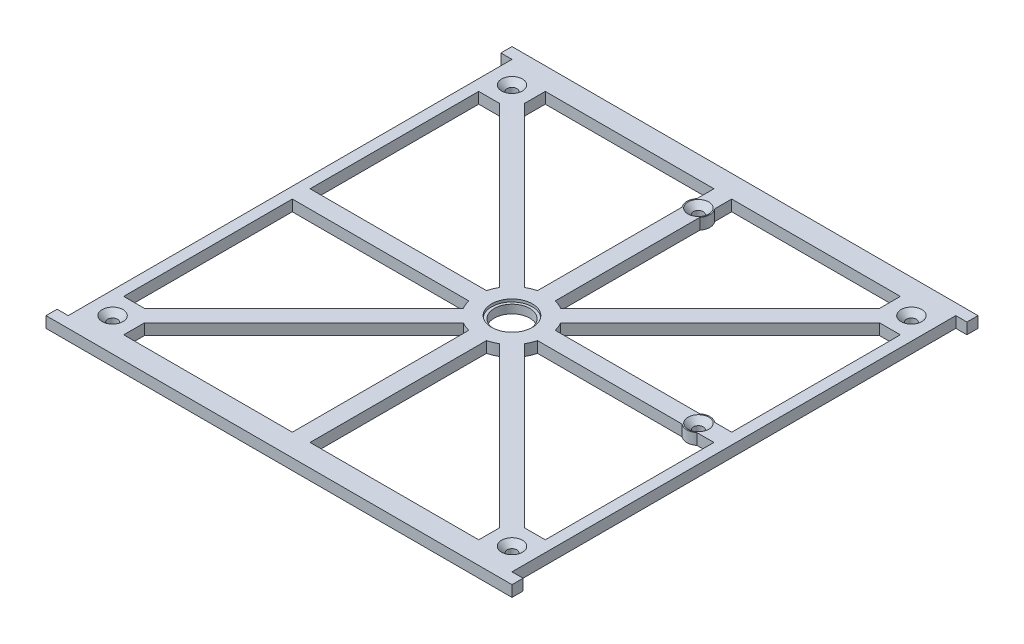
from build123d import *

# Parameters (mm, degrees)
SKETCH1_W           = 100
SKETCH1_H           = 105
SKETCH1_R           = 1.1
BOSS_EXTRUDE1_DEPTH = 2.5
SKETCH3_R           = 4
SKETCH3_R_2         = 1.1
BOSS_EXTRUDE2_DEPTH = 2.5
CHAMFER1_SIZE       = 1.25
SKETCH2_R           = 4.6
CUT_EXTRUDE1_DEPTH  = 0.6
SKETCH11_W          = 2.5
SKETCH11_H          = 2.5
BOSS_EXTRUDE5_DEPTH = 2.5


with BuildPart() as part:
    # Sketch1 → Boss-Extrude1 (new body)
    with BuildSketch(Plane(origin=(0, 0, 0), x_dir=(1, 0, 0), z_dir=(0, 1, 0))):
        Rectangle(SKETCH1_W, SKETCH1_H)
        with Locations(Location((-45, 45, 0), (0, 0, 270))):
            Circle(SKETCH1_R, mode=Mode.SUBTRACT)
        with Locations(Location((45, 45, 0), (0, 0, 90))):
            Circle(SKETCH1_R, mode=Mode.SUBTRACT)
        with Locations(Location((45, -45, 0), (0, 0, 270))):
            Circle(SKETCH1_R, mode=Mode.SUBTRACT)
        with Locations(Location((-45, -45, 0), (0, 0, 90))):
            Circle(SKETCH1_R, mode=Mode.SUBTRACT)
        Polygon((-40, 47.5), (40, 47.5), (40, 40), (47.5, 40), (47.5, -40), (40, -40), (40, -47.5), (-40, -47.5), (-40, -40), (-47.5, -40), (-47.5, 40), (-40, 40), align=None, mode=Mode.SUBTRACT)
    extrude(amount=BOSS_EXTRUDE1_DEPTH)

    # Sketch3 → Boss-Extrude2 (add)
    with BuildSketch(Plane(origin=(0, 0, 0), x_dir=(1, 0, 0), z_dir=(0, 1, 0))):
        with BuildLine():
            Line((-42.828427125, 40), (-6.891439137, 4.063012013))
            ThreePointArc((-6.891439137, 4.063012013), (-7.39103626, 3.061467459), (-7.745966692, 2))
            Line((-7.745966692, 2), (-40.338668084, 2))
            Line((-40.338668084, 2), (-47.5, 2))
            Line((-47.5, 2), (-47.5, -2))
            Line((-47.5, -2), (-43.661317629, -2))
            Line((-43.661317629, -2), (-7.745966692, -2))
            ThreePointArc((-7.745966692, -2), (-7.39103626, -3.061467459), (-6.891439137, -4.063012013))
            Line((-6.891439137, -4.063012013), (-42.828427125, -40))
            Line((-42.828427125, -40), (-40, -42.828427125))
            Line((-40, -42.828427125), (-4.063012013, -6.891439137))
            ThreePointArc((-4.063012013, -6.891439137), (-3.061467459, -7.39103626), (-2, -7.745966692))
            Line((-2, -7.745966692), (-2, -43.661317629))
            Line((-2, -43.661317629), (-2, -47.5))
            Line((-2, -47.5), (2, -47.5))
            Line((2, -47.5), (2, -43.661317629))
            Line((2, -43.661317629), (2, -7.745966692))
            ThreePointArc((2, -7.745966692), (3.061467459, -7.39103626), (4.063012013, -6.891439137))
            Line((4.063012013, -6.891439137), (40, -42.828427125))
            Line((40, -42.828427125), (42.828427125, -40))
            Line((42.828427125, -40), (6.891439137, -4.063012013))
            ThreePointArc((6.891439137, -4.063012013), (7.39103626, -3.061467459), (7.745966692, -2))
            Line((7.745966692, -2), (40.338675227, -2))
            ThreePointArc((40.338675227, -2), (42, -2.6), (43.661324773, -2))
            Line((43.661324773, -2), (47.5, -2))
            Line((47.5, -2), (47.5, 2))
            Line((47.5, 2), (43.661324773, 2))
            ThreePointArc((43.661324773, 2), (42, 2.6), (40.338675227, 2))
            Line((40.338675227, 2), (7.745966692, 2))
            ThreePointArc((7.745966692, 2), (7.39103626, 3.061467459), (6.891439137, 4.063012013))
            Line((6.891439137, 4.063012013), (42.828427125, 40))
            Line((42.828427125, 40), (40, 42.828427125))
            Line((40, 42.828427125), (4.063012013, 6.891439137))
            ThreePointArc((4.063012013, 6.891439137), (3.061467459, 7.39103626), (2, 7.745966692))
            Line((2, 7.745966692), (2, 40.338675227))
            ThreePointArc((2, 40.338675227), (2.6, 42), (2, 43.661324773))
            Line((2, 43.661324773), (2, 47.5))
            Line((2, 47.5), (-2, 47.5))
            Line((-2, 47.5), (-2, 43.661324773))
            ThreePointArc((-2, 43.661324773), (-2.6, 42), (-2, 40.338675227))
            Line((-2, 40.338675227), (-2, 7.745966692))
            ThreePointArc((-2, 7.745966692), (-3.061467459, 7.39103626), (-4.063012013, 6.891439137))
            Line((-4.063012013, 6.891439137), (-40, 42.828427125))
            Line((-40, 42.828427125), (-42.828427125, 40))
        make_face()
        with Locations(Location((0, 0, 0), (0, 0, 270))):
            Circle(SKETCH3_R, mode=Mode.SUBTRACT)
        with Locations(Location((0, 42, 0), (0, 0, 270))):
            Circle(SKETCH3_R_2, mode=Mode.SUBTRACT)
        with Locations(Location((42, 0, 0), (0, 0, 270))):
            Circle(SKETCH3_R_2, mode=Mode.SUBTRACT)
    extrude(amount=BOSS_EXTRUDE2_DEPTH)

    # Chamfer1
    chamfer1_edges = [part.edges().sort_by_distance(p)[0] for p in [
        (42, 2.5, -1.1),
        (-45, 2.5, -46.1),
        (45, 2.5, -43.9),
        (45, 2.5, 43.9),
        (-45, 2.5, 46.1),
        (0, 2.5, -43.1),
    ]]
    chamfer(chamfer1_edges, length=CHAMFER1_SIZE)

    # Sketch2 → Cut-Extrude1 (cut)
    with BuildSketch(Plane(origin=(0, 2.5, 0), x_dir=(1, 0, 0), z_dir=(0, 1, 0))):
        with Locations(Location((0, 0, 0), (0, 0, 270))):
            Circle(SKETCH2_R)
    extrude(amount=-CUT_EXTRUDE1_DEPTH, mode=Mode.SUBTRACT)

    # Sketch11 → Boss-Extrude5 (add)
    with BuildSketch(Plane(origin=(0, 2.5, 0), x_dir=(1, 0, 0), z_dir=(0, 1, 0))):
        with Locations((-51.25, 51.25)):
            Rectangle(SKETCH11_W, SKETCH11_H)
        with Locations((51.25, 51.25)):
            Rectangle(SKETCH11_W, SKETCH11_H)
        with Locations((-51.25, -51.25)):
            Rectangle(SKETCH11_W, SKETCH11_H)
        with Locations((51.25, -51.25)):
            Rectangle(SKETCH11_W, SKETCH11_H)
    extrude(amount=-BOSS_EXTRUDE5_DEPTH)


solid = part.part
